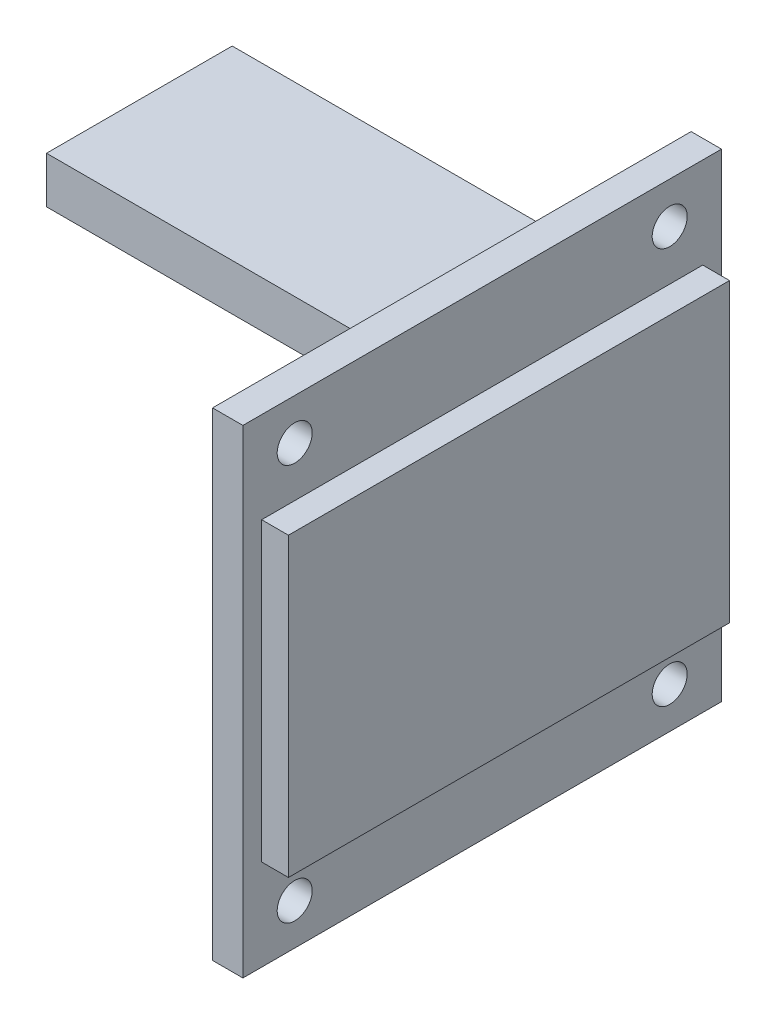
from build123d import *

# Parameters (mm, degrees)
SKETCH_1_W          = 26.8
SKETCH_1_H          = 26.8
EXTRUDE_1_DEPTH     = 3.2
SKETCH_2_W          = 26.8
SKETCH_2_H          = 26.8
SKETCH_2_W_2        = 24.7
SKETCH_2_H_2        = 16.6
CUT_EXTRUDE_1_DEPTH = 1.5
SKETCH_3_W          = 10.4
SKETCH_3_H          = 2.6
EXTRUDE_2_DEPTH     = 17.5
SKETCH_4_W          = 23
SKETCH_4_H          = 6
EXTRUDE_3_DEPTH     = 1.5
SKETCH_5_R          = 0.98
CUT_EXTRUDE_2_DEPTH = 10


with BuildPart() as part:
    # 草图1 → 凸台-拉伸1 (new body)
    with BuildSketch(Plane(origin=(0, 0, 0), x_dir=(0, 0, -1), z_dir=(1, 0, 0))):
        Rectangle(SKETCH_1_W, SKETCH_1_H)
    extrude(amount=EXTRUDE_1_DEPTH)

    # 草图2 → 切除-拉伸1 (cut)
    with BuildSketch(Plane(origin=(3.2, 0, 0), x_dir=(0, 0, -1), z_dir=(1, 0, 0))):
        Rectangle(SKETCH_2_W, SKETCH_2_H)
        Rectangle(SKETCH_2_W_2, SKETCH_2_H_2, mode=Mode.SUBTRACT)
    extrude(amount=-CUT_EXTRUDE_1_DEPTH, mode=Mode.SUBTRACT)

    # 草图3 → 凸台-拉伸2 (add)
    with BuildSketch(Plane.ZY):
        with Locations((0, 11.6)):
            Rectangle(SKETCH_3_W, SKETCH_3_H)
    extrude(amount=EXTRUDE_2_DEPTH)

    # 草图4 → 凸台-拉伸3 (add)
    with BuildSketch(Plane.ZY):
        with Locations((0, 0.6)):
            Rectangle(SKETCH_4_W, SKETCH_4_H)
    extrude(amount=EXTRUDE_3_DEPTH)

    # 草图5 → 切除-拉伸2 (cut)
    with BuildSketch(Plane(origin=(1.7, 0, 0), x_dir=(0, 0, -1), z_dir=(1, 0, 0))):
        with Locations((-10.5, 11.1)):
            Circle(SKETCH_5_R)
        with Locations((10.5, 11.1)):
            Circle(SKETCH_5_R)
        with Locations((10.5, -11.1)):
            Circle(SKETCH_5_R)
        with Locations((-10.5, -11.1)):
            Circle(SKETCH_5_R)
    extrude(amount=-CUT_EXTRUDE_2_DEPTH, mode=Mode.SUBTRACT)


solid = part.part
